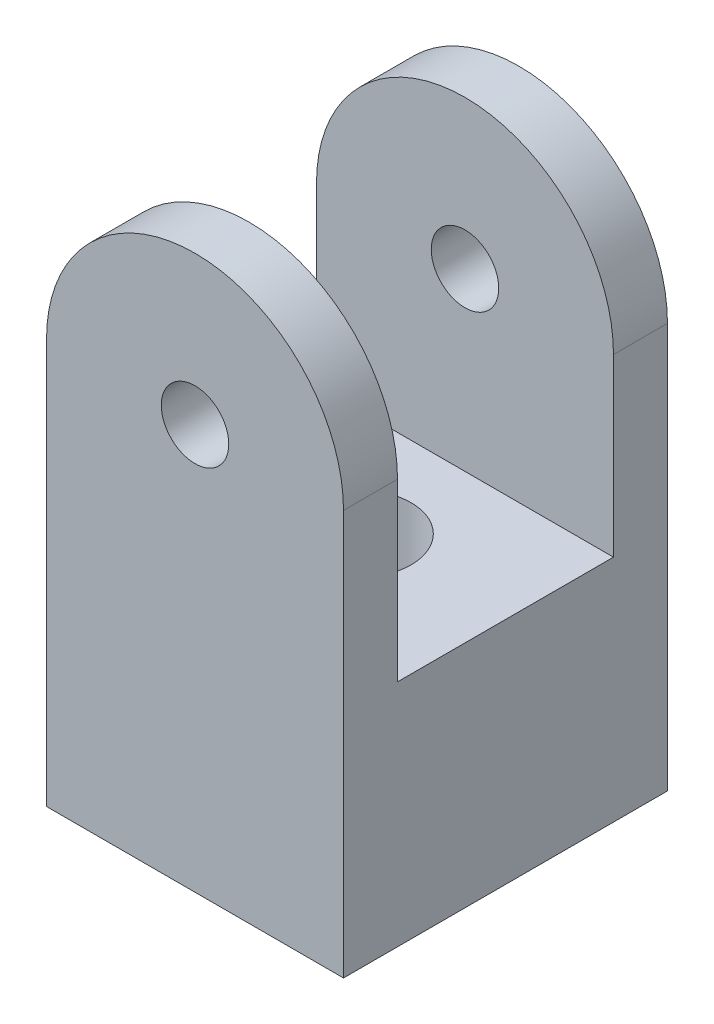
from build123d import *

# Parameters (mm, degrees)
CROQUIS1_W              = 22
CROQUIS1_H              = 24
SALIENTE_EXTRUIR1_DEPTH = 30
SALIENTE_EXTRUIR2_DEPTH = 24
CROQUIS4_W              = 16
CROQUIS4_H              = 27.551854113
CORTAR_EXTRUIR1_DEPTH   = 24
CROQUIS5_R              = 4
CORTAR_EXTRUIR2_DEPTH   = 24
CROQUIS6_R              = 2.5
CORTAR_EXTRUIR3_DEPTH   = 49.764741361


with BuildPart() as part:
    # Croquis1 → Saliente-Extruir1 (new body)
    with BuildSketch(Plane(origin=(0, 0, 0), x_dir=(1, 0, 0), z_dir=(0, 1, 0))):
        Rectangle(CROQUIS1_W, CROQUIS1_H)
    extrude(amount=SALIENTE_EXTRUIR1_DEPTH)

    # Croquis3 → Saliente-Extruir2 (add)
    with BuildSketch(Plane.XY.offset(12)):
        with BuildLine():
            Line((-11, 30), (11, 30))
            ThreePointArc((11, 30), (0, 41), (-11, 30))
        make_face()
    extrude(amount=-SALIENTE_EXTRUIR2_DEPTH)

    # Croquis4 → Cortar-Extruir1 (cut)
    with BuildSketch(Plane(origin=(11, 0, 0), x_dir=(0, 0, -1), z_dir=(1, 0, 0))):
        with Locations((0, 30.775927057)):
            Rectangle(CROQUIS4_W, CROQUIS4_H)
    extrude(amount=-CORTAR_EXTRUIR1_DEPTH, mode=Mode.SUBTRACT)

    # Croquis5 → Cortar-Extruir2 (cut)
    with BuildSketch(Plane(origin=(0, 17, 0), x_dir=(1, 0, 0), z_dir=(0, 1, 0))):
        with Locations(Location((0, 0, 0), (0, 0, 270))):
            Circle(CROQUIS5_R)
    extrude(amount=-CORTAR_EXTRUIR2_DEPTH, mode=Mode.SUBTRACT)

    # Croquis6 → Cortar-Extruir3 (cut, through all)
    with BuildSketch(Plane.XY.offset(12)):
        with Locations((0, 30)):
            Circle(CROQUIS6_R)
    extrude(amount=-CORTAR_EXTRUIR3_DEPTH, mode=Mode.SUBTRACT)


solid = part.part
